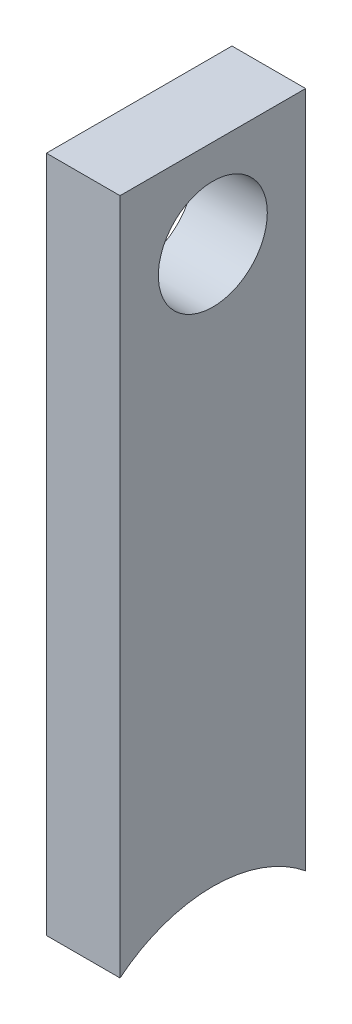
from build123d import *

# Parameters (mm, degrees)
BOSS_EXTRUDE1_DEPTH     = 25
CUT_EXTRUDE1_DEPTH      = 122.828773284
CUT_EXTRUDE1_DEPTH_BACK = 122.828773284
SKETCH2_R               = 18.5


with BuildPart() as part:
    # Sketch1 → Boss-Extrude1 (new body)
    with BuildSketch(Plane(origin=(0, 0, 0), x_dir=(0, 0, -1), z_dir=(1, 0, 0))):
        with BuildLine():
            Line((-31.5, -115), (-31.5, 115))
            Line((-31.5, 115), (31.5, 115))
            Line((31.5, 115), (31.5, -115))
            ThreePointArc((31.5, -115), (0, -103.829756631), (-31.5, -115))
        make_face()
    extrude(amount=BOSS_EXTRUDE1_DEPTH)

    # Sketch2 → Cut-Extrude1 (cut, two sides: drawn at the far end of the back side and taken through both)
    with BuildSketch(Plane(origin=(25, 0, 0), x_dir=(0, 0, -1), z_dir=(1, 0, 0)).offset(-CUT_EXTRUDE1_DEPTH_BACK)):
        with Locations((0, 85)):
            Circle(SKETCH2_R)
    extrude(amount=CUT_EXTRUDE1_DEPTH + CUT_EXTRUDE1_DEPTH_BACK, mode=Mode.SUBTRACT)


solid = part.part
